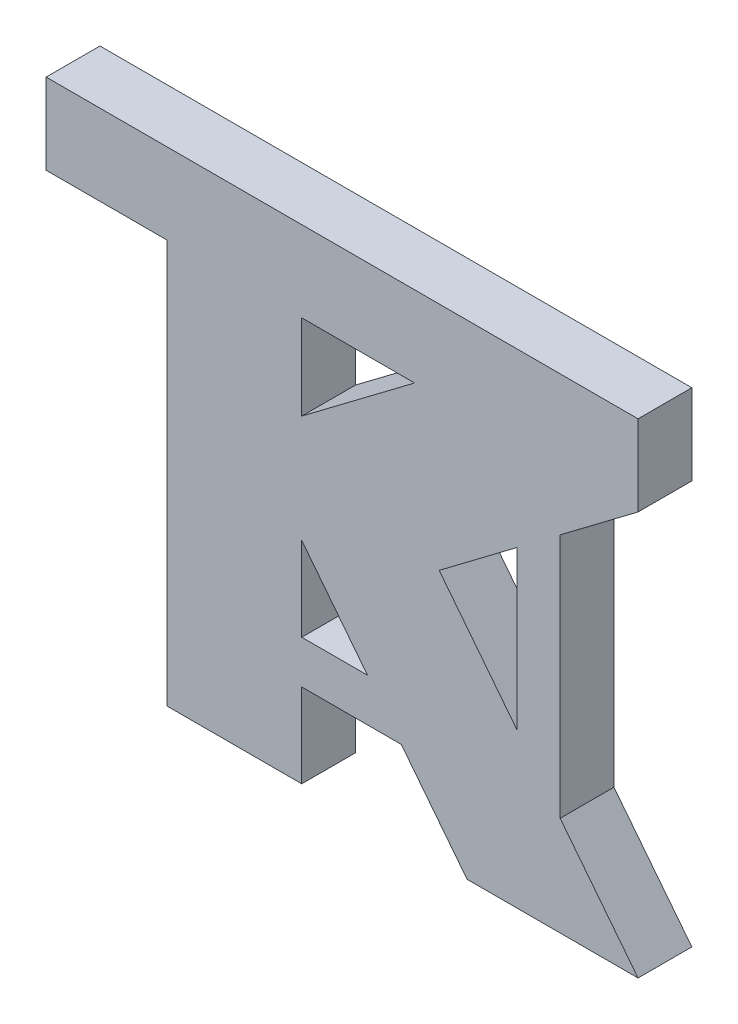
from build123d import *

# Parameters (mm, degrees)
BOSS_EXTRUDE1_DEPTH = 10


with BuildPart() as part:
    # Sketch1 → Boss-Extrude1 (new body)
    # profile 1 of 3: a face of its own
    with BuildSketch(Plane.XY):
        Polygon((87.5, 75), (87.5, 90), (-22.5, 90), (-22.5, 75), (0, 75), (0, 0), (25, 0), (25, 39.184229931), (55.729251038, 0), (87.5, 0), (50.538942191, 47.130682941), align=None)
        Polygon((45.975310969, 75), (25, 59.184229931), (25, 75), align=None, mode=Mode.SUBTRACT)
    # profile 2 of 3: a face of its own
    with BuildSketch(Plane.XY):
        Polygon((25, 23.592114965), (25, 15.592114965), (43.501525347, 15.592114965), (37.22772569, 23.592114965), align=None)
    # profile 3 of 3: a face of its own
    with BuildSketch(Plane.XY):
        Polygon((73.019471096, 18.464764189), (73.019471096, 64.081415004), (65.019471096, 58.049267937), (65.019471096, 28.665918752), align=None)
    extrude(amount=BOSS_EXTRUDE1_DEPTH)


solid = part.part
